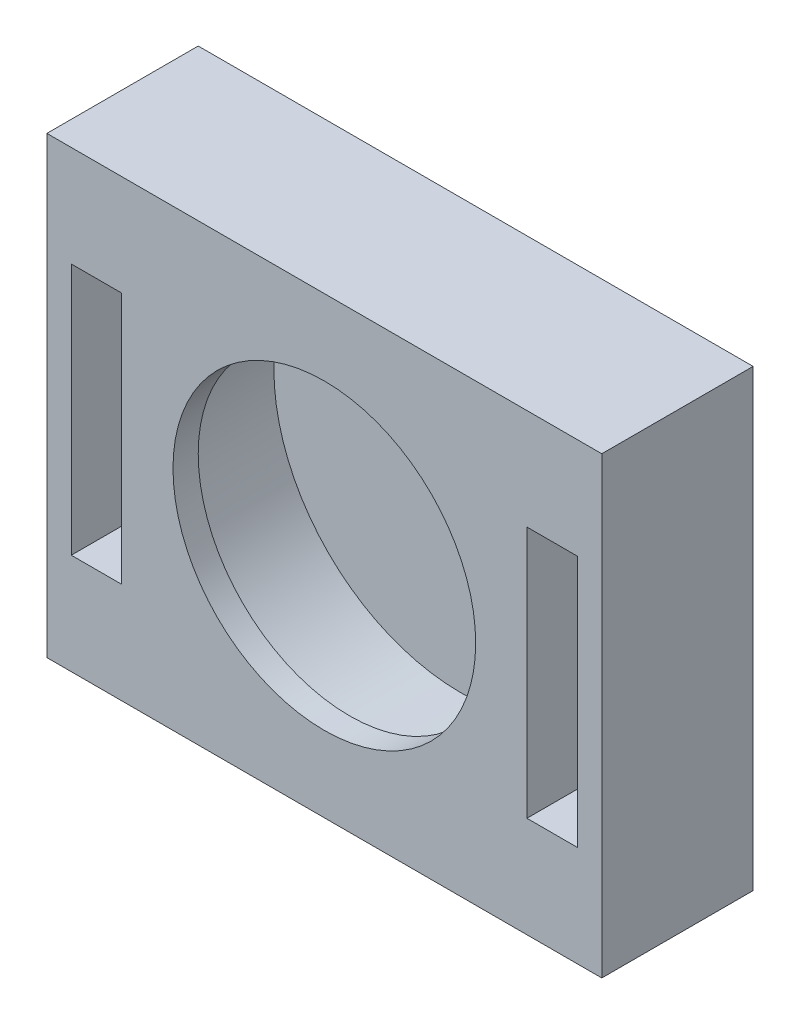
from build123d import *

# Parameters (mm, degrees)
SKETCH1_W           = 27.94
SKETCH1_H           = 22.86
BOSS_EXTRUDE1_DEPTH = 6.35
SKETCH2_R           = 9.398
CUT_EXTRUDE1_DEPTH  = 5.588
SKETCH3_W           = 27.94
SKETCH3_H           = 22.86
SKETCH3_R           = 7.62
BOSS_EXTRUDE2_DEPTH = 1.27
SKETCH9_W           = 2.54
SKETCH9_H           = 12.7
CUT_EXTRUDE3_DEPTH  = 7.62


with BuildPart() as part:
    # Sketch1 → Boss-Extrude1 (new body)
    with BuildSketch(Plane.XY):
        Rectangle(SKETCH1_W, SKETCH1_H)
    extrude(amount=BOSS_EXTRUDE1_DEPTH)

    # Sketch2 → Cut-Extrude1 (cut)
    with BuildSketch(Plane.XY.offset(6.35)):
        Circle(SKETCH2_R)
    extrude(amount=-CUT_EXTRUDE1_DEPTH, mode=Mode.SUBTRACT)

    # Sketch3 → Boss-Extrude2 (add)
    with BuildSketch(Plane.XY.offset(6.35)):
        Rectangle(SKETCH3_W, SKETCH3_H)
        Circle(SKETCH3_R, mode=Mode.SUBTRACT)
    extrude(amount=BOSS_EXTRUDE2_DEPTH)

    # Sketch9 → Cut-Extrude3 (cut)
    with BuildSketch(Plane.XY.offset(7.62)):
        with Locations((-11.47066929, 0)):
            Rectangle(SKETCH9_W, SKETCH9_H)
        with Locations((11.47066929, 0)):
            Rectangle(SKETCH9_W, SKETCH9_H)
    extrude(amount=-CUT_EXTRUDE3_DEPTH, mode=Mode.SUBTRACT)


solid = part.part
